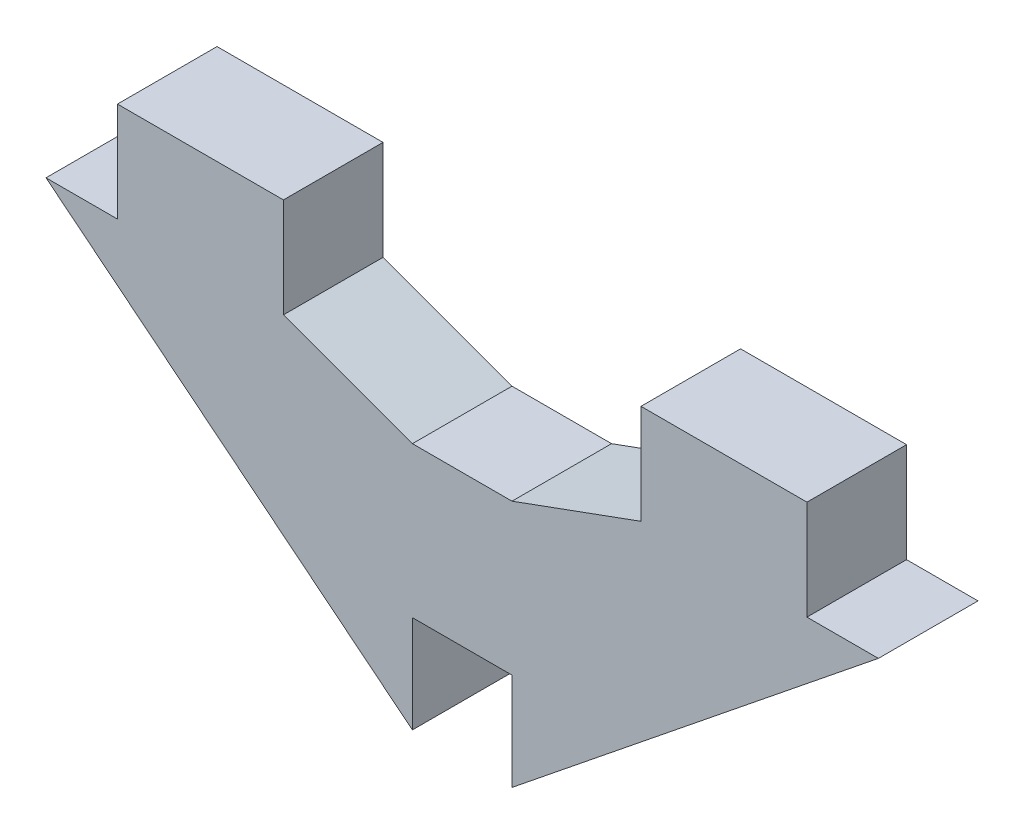
from build123d import *

# Parameters (mm, degrees)
BOSS_EXTRUDE1_DEPTH = 1.524


with BuildPart() as part:
    # Sketch1 → Boss-Extrude1 (new body)
    with BuildSketch(Plane.XY):
        Polygon((0, 54.283940604), (1.524, 54.283940604), (1.524, 52.795308101), (7.131303257, 57.309318796), (6.037871264, 57.309318796), (6.037871264, 58.833318796), (3.497871264, 58.833318796), (3.497871264, 57.309318796), (1.524, 56.589347717), (0, 56.589347717), (-1.973871264, 57.309318796), (-1.973871264, 58.833318796), (-4.513871264, 58.833318796), (-4.513871264, 57.309318796), (-5.607303257, 57.309318796), (0, 52.795308101), align=None)
    extrude(amount=BOSS_EXTRUDE1_DEPTH)


solid = part.part
